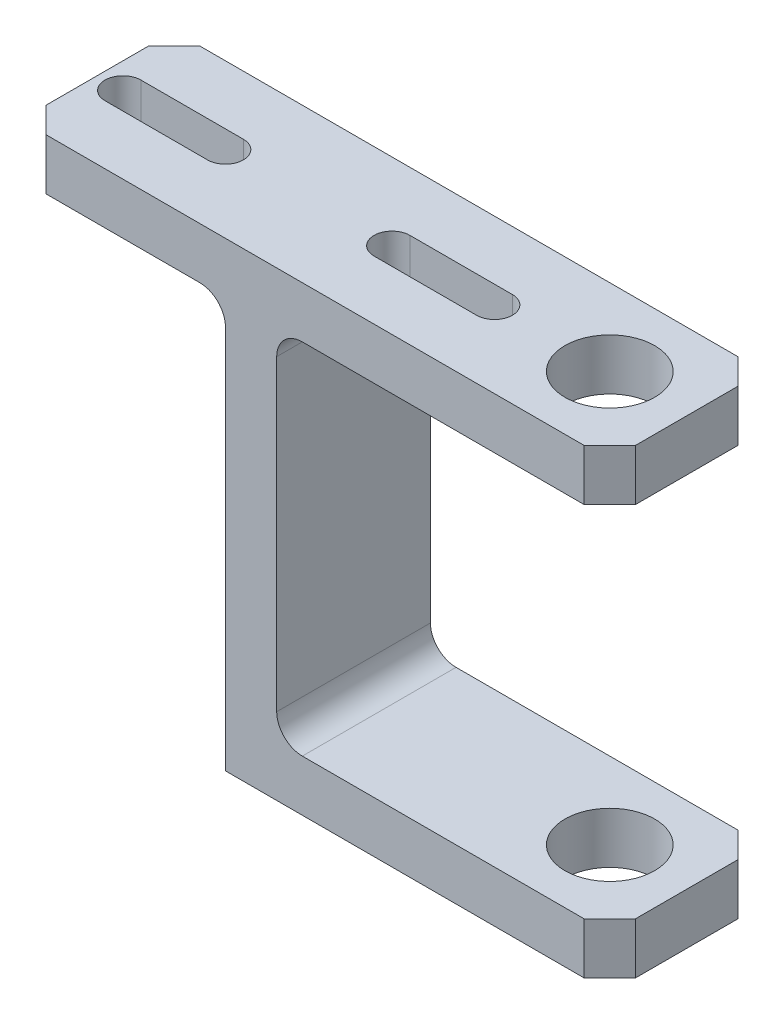
from build123d import *

# Parameters (mm, degrees)
BOSS_EXTRUDE1_DEPTH = 30
CHAMFER1_SIZE       = 10
CHAMFER2_SIZE       = 10
SKETCH2_R           = 17.5
CUT_EXTRUDE1_DEPTH  = 212
CUT_EXTRUDE2_DEPTH  = 111


with BuildPart() as part:
    # Sketch1 → Boss-Extrude1 (new, symmetric)
    with BuildSketch(Plane.XY):
        with BuildLine():
            Line((0, 150), (0, 0))
            Line((0, 0), (150, 0))
            Line((150, 0), (150, 20))
            Line((150, 20), (30, 20))
            ThreePointArc((30, 20), (22.928932188, 22.928932188), (20, 30))
            Line((20, 30), (20, 150))
            ThreePointArc((20, 150), (22.928932188, 157.071067812), (30, 160))
            Line((30, 160), (150, 160))
            Line((150, 160), (150, 180))
            Line((150, 180), (-80, 180))
            Line((-80, 180), (-80, 160))
            Line((-80, 160), (-10, 160))
            ThreePointArc((-10, 160), (-2.928932188, 157.071067812), (0, 150))
        make_face()
    extrude(amount=BOSS_EXTRUDE1_DEPTH, both=True)

    # Chamfer1
    chamfer1_edges = [part.edges().sort_by_distance(p)[0] for p in [
        (150, 170, 30),
    ]]
    chamfer(chamfer1_edges, length=CHAMFER1_SIZE)

    # Chamfer2
    chamfer2_edges = [part.edges().sort_by_distance(p)[0] for p in [
        (-80, 170, 30),
        (150, 10, -30),
        (150, 170, -30),
        (-80, 170, -30),
        (150, 10, 30),
    ]]
    chamfer(chamfer2_edges, length=CHAMFER2_SIZE)

    # Sketch2 → Cut-Extrude1 (cut)
    with BuildSketch(Plane(origin=(0, 180, 0), x_dir=(1, 0, 0), z_dir=(0, 1, 0))):
        with BuildLine():
            ThreePointArc((-30, 7), (-23, 0), (-30, -7))
            Line((-30, -7), (-70, -7))
            ThreePointArc((-70, -7), (-77, 0), (-70, 7))
            Line((-70, 7), (-30, 7))
        make_face()
        with Locations(Location((120, 0, 0), (0, 0, 180))):
            Circle(SKETCH2_R)
    extrude(amount=-CUT_EXTRUDE1_DEPTH, mode=Mode.SUBTRACT)

    # Sketch4 → Cut-Extrude2 (cut)
    with BuildSketch(Plane(origin=(0, 180, 0), x_dir=(1, 0, 0), z_dir=(0, 1, 0))):
        with BuildLine():
            Line((75, 7), (35, 7))
            ThreePointArc((35, 7), (28, 0), (35, -7))
            Line((35, -7), (75, -7))
            ThreePointArc((75, -7), (82, 0), (75, 7))
        make_face()
    extrude(amount=-CUT_EXTRUDE2_DEPTH, mode=Mode.SUBTRACT)


solid = part.part
